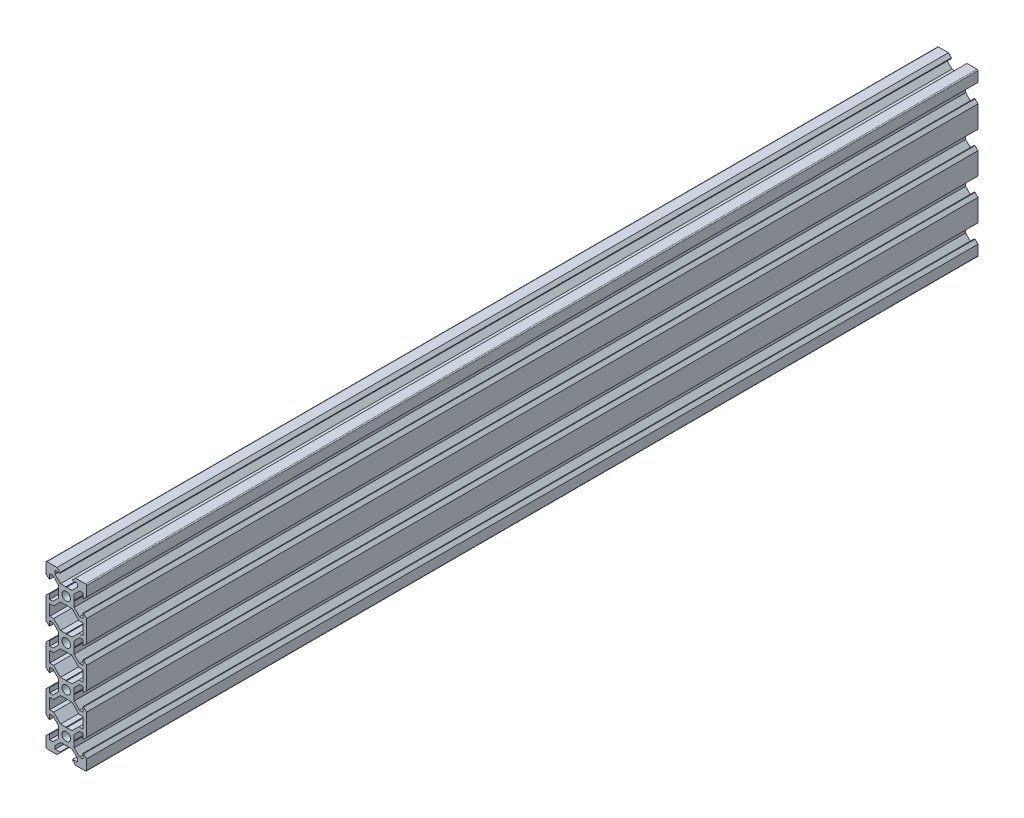
from build123d import *

# Parameters (mm, degrees)
BOSS_EXTRU_1_DEPTH = 440


with BuildPart() as part:
    # Esquisse1 → Boss.-Extru.1 (new body)
    with BuildSketch(Plane.XY):
        with BuildLine():
            Line((-9.5, 10), (-4.58, 10))
            Line((-4.58, 10), (-3.125, 8.545))
            Line((-3.125, 8.545), (-3.125, 8.2))
            Line((-3.125, 8.2), (-5.5, 8.2))
            Line((-5.5, 8.2), (-5.5, 6.560660172))
            Line((-5.5, 6.560660172), (-2.839339828, 3.9))
            Line((-2.839339828, 3.9), (-0.21, 3.9))
            Line((-0.21, 3.9), (0, 3.69))
            Line((0, 3.69), (0, 2.1))
            ThreePointArc((0, 2.1), (-2.1, 0), (0, -2.1))
            Line((0, -2.1), (0, -3.69))
            Line((0, -3.69), (-0.21, -3.9))
            Line((-0.21, -3.9), (-2.839339828, -3.9))
            Line((-2.839339828, -3.9), (-6.239339828, -7.3))
            Line((-6.239339828, -7.3), (-8.2, -7.3))
            Line((-8.2, -7.3), (-8.2, -12.7))
            Line((-8.2, -12.7), (-6.239339828, -12.7))
            Line((-6.239339828, -12.7), (-2.839339828, -16.1))
            Line((-2.839339828, -16.1), (-0.21, -16.1))
            Line((-0.21, -16.1), (0, -16.31))
            Line((0, -16.31), (0, -17.9))
            ThreePointArc((0, -17.9), (-2.1, -20), (0, -22.1))
            Line((0, -22.1), (0, -23.69))
            Line((0, -23.69), (-0.21, -23.9))
            Line((-0.21, -23.9), (-2.839339828, -23.9))
            Line((-2.839339828, -23.9), (-6.239339828, -27.3))
            Line((-6.239339828, -27.3), (-8.2, -27.3))
            Line((-8.2, -27.3), (-8.2, -32.7))
            Line((-8.2, -32.7), (-6.239339828, -32.7))
            Line((-6.239339828, -32.7), (-2.839339828, -36.1))
            Line((-2.839339828, -36.1), (-0.21, -36.1))
            Line((-0.21, -36.1), (0, -36.31))
            Line((0, -36.31), (0, -37.9))
            ThreePointArc((0, -37.9), (-2.1, -40), (0, -42.1))
            Line((0, -42.1), (0, -43.69))
            Line((0, -43.69), (-0.21, -43.9))
            Line((-0.21, -43.9), (-2.839339828, -43.9))
            Line((-2.839339828, -43.9), (-6.239339828, -47.3))
            Line((-6.239339828, -47.3), (-8.2, -47.3))
            Line((-8.2, -47.3), (-8.2, -52.7))
            Line((-8.2, -52.7), (-6.239339828, -52.7))
            Line((-6.239339828, -52.7), (-2.839339828, -56.1))
            Line((-2.839339828, -56.1), (-0.21, -56.1))
            Line((-0.21, -56.1), (0, -56.31))
            Line((0, -56.31), (0, -57.9))
            ThreePointArc((0, -57.9), (-2.1, -60), (0, -62.1))
            Line((0, -62.1), (0, -63.69))
            Line((0, -63.69), (-0.21, -63.9))
            Line((-0.21, -63.9), (-2.839339828, -63.9))
            Line((-2.839339828, -63.9), (-5.5, -66.560660172))
            Line((-5.5, -66.560660172), (-5.5, -68.2))
            Line((-5.5, -68.2), (-3.125, -68.2))
            Line((-3.125, -68.2), (-3.125, -68.545))
            Line((-3.125, -68.545), (-4.58, -70))
            Line((-4.58, -70), (-9.5, -70))
            ThreePointArc((-9.5, -70), (-9.853553391, -69.853553391), (-10, -69.5))
            Line((-10, -69.5), (-10, -64.58))
            Line((-10, -64.58), (-8.545, -63.125))
            Line((-8.545, -63.125), (-8.2, -63.125))
            Line((-8.2, -63.125), (-8.2, -65.5))
            Line((-8.2, -65.5), (-6.560660172, -65.5))
            Line((-6.560660172, -65.5), (-3.9, -62.839339828))
            Line((-3.9, -62.839339828), (-3.9, -60.21))
            Line((-3.9, -60.21), (-3.69, -60))
            Line((-3.69, -60), (-3.9, -59.79))
            Line((-3.9, -59.79), (-3.9, -57.160660172))
            Line((-3.9, -57.160660172), (-6.560660172, -54.5))
            Line((-6.560660172, -54.5), (-8.2, -54.5))
            Line((-8.2, -54.5), (-8.2, -56.875))
            Line((-8.2, -56.875), (-8.545, -56.875))
            Line((-8.545, -56.875), (-10, -55.42))
            Line((-10, -55.42), (-10, -44.58))
            Line((-10, -44.58), (-8.545, -43.125))
            Line((-8.545, -43.125), (-8.2, -43.125))
            Line((-8.2, -43.125), (-8.2, -45.5))
            Line((-8.2, -45.5), (-6.560660172, -45.5))
            Line((-6.560660172, -45.5), (-3.9, -42.839339828))
            Line((-3.9, -42.839339828), (-3.9, -40.21))
            Line((-3.9, -40.21), (-3.69, -40))
            Line((-3.69, -40), (-3.9, -39.79))
            Line((-3.9, -39.79), (-3.9, -37.160660172))
            Line((-3.9, -37.160660172), (-6.560660172, -34.5))
            Line((-6.560660172, -34.5), (-8.2, -34.5))
            Line((-8.2, -34.5), (-8.2, -36.875))
            Line((-8.2, -36.875), (-8.545, -36.875))
            Line((-8.545, -36.875), (-10, -35.42))
            Line((-10, -35.42), (-10, -24.58))
            Line((-10, -24.58), (-8.545, -23.125))
            Line((-8.545, -23.125), (-8.2, -23.125))
            Line((-8.2, -23.125), (-8.2, -25.5))
            Line((-8.2, -25.5), (-6.560660172, -25.5))
            Line((-6.560660172, -25.5), (-3.9, -22.839339828))
            Line((-3.9, -22.839339828), (-3.9, -20.21))
            Line((-3.9, -20.21), (-3.69, -20))
            Line((-3.69, -20), (-3.9, -19.79))
            Line((-3.9, -19.79), (-3.9, -17.160660172))
            Line((-3.9, -17.160660172), (-6.560660172, -14.5))
            Line((-6.560660172, -14.5), (-8.2, -14.5))
            Line((-8.2, -14.5), (-8.2, -16.875))
            Line((-8.2, -16.875), (-8.545, -16.875))
            Line((-8.545, -16.875), (-10, -15.42))
            Line((-10, -15.42), (-10, -4.58))
            Line((-10, -4.58), (-8.545, -3.125))
            Line((-8.545, -3.125), (-8.2, -3.125))
            Line((-8.2, -3.125), (-8.2, -5.5))
            Line((-8.2, -5.5), (-6.560660172, -5.5))
            Line((-6.560660172, -5.5), (-3.9, -2.839339828))
            Line((-3.9, -2.839339828), (-3.9, -0.21))
            Line((-3.9, -0.21), (-3.69, 0))
            Line((-3.69, 0), (-3.9, 0.21))
            Line((-3.9, 0.21), (-3.9, 2.839339828))
            Line((-3.9, 2.839339828), (-6.560660172, 5.5))
            Line((-6.560660172, 5.5), (-8.2, 5.5))
            Line((-8.2, 5.5), (-8.2, 3.125))
            Line((-8.2, 3.125), (-8.545, 3.125))
            Line((-8.545, 3.125), (-10, 4.58))
            Line((-10, 4.58), (-10, 9.5))
            ThreePointArc((-10, 9.5), (-9.853553391, 9.853553391), (-9.5, 10))
        make_face()
    boss_extru_1 = extrude(amount=BOSS_EXTRU_1_DEPTH)

    # Symétrie1: Boss.-Extru.1 across Right Plane
    add(boss_extru_1.mirror(Plane(origin=(0, 0, 0), x_dir=(0, 0, -1), z_dir=(1, 0, 0))))


solid = part.part
